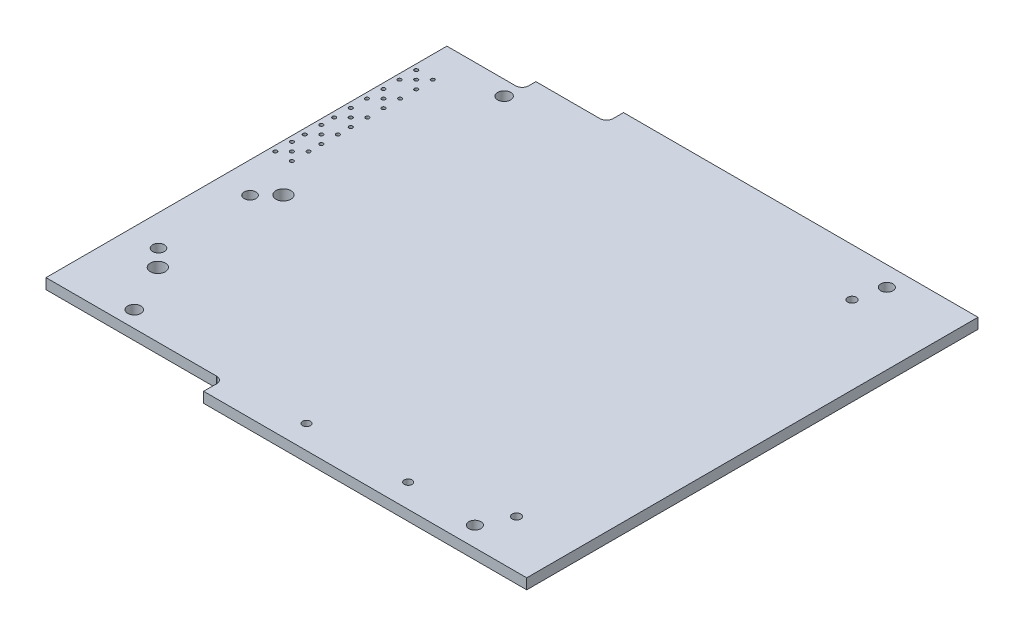
from build123d import *

# Parameters (mm, degrees)
SKETCH2_R           = 1
SKETCH2_R_2         = 1.15
SKETCH2_R_3         = 0.9
SKETCH2_R_4         = 0.595
SKETCH2_R_5         = 0.9271
SKETCH2_R_6         = 0.6604
SKETCH2_R_7         = 0.28
BOSS_EXTRUDE1_DEPTH = 1.6


with BuildPart() as part:
    # Sketch2 → Boss-Extrude1 (new body)
    with BuildSketch(Plane(origin=(0, 0, 0), x_dir=(1, 0, 0), z_dir=(0, 1, 0))):
        with BuildLine():
            Line((10.8682, -3), (10.9, -3))
            Line((10.9, -3), (10.9, -2.9682))
            Line((10.9, -2.9682), (10.9, 65.9682))
            Line((10.9, 65.9682), (10.9, 66))
            Line((10.9, 66), (10.8682, 66))
            Line((10.8682, 66), (-43.2683, 66))
            Line((-43.2683, 66), (-43.3, 66))
            Line((-43.3, 66), (-43.3, 65.9682))
            Line((-43.3, 65.9682), (-43.3, 64.431749961))
            ThreePointArc((-43.3, 64.431749961), (-43.277581689, 64.422432956), (-43.2683, 64.4))
            ThreePointArc((-43.2683, 64.4), (-43.277760728, 64.377389143), (-43.300504779, 64.368253257))
            ThreePointArc((-43.300504779, 64.368253257), (-43.5929, 63.6929), (-44.268253257, 63.400504779))
            ThreePointArc((-44.268253257, 63.400504779), (-44.277389143, 63.377760728), (-44.3, 63.3683))
            ThreePointArc((-44.3, 63.3683), (-44.322432956, 63.377581689), (-44.331749961, 63.4))
            Line((-44.331749961, 63.4), (-54.0682, 63.4))
            Line((-54.0682, 63.4), (-54.1, 63.4))
            Line((-54.1, 63.4), (-54.1, 63.3683))
            Line((-54.1, 63.3683), (-54.1, 62.3318))
            ThreePointArc((-54.1, 62.3318), (-54.077514004, 62.322485996), (-54.0682, 62.3))
            ThreePointArc((-54.0682, 62.3), (-54.077693743, 62.277335692), (-54.100506344, 62.268204031))
            ThreePointArc((-54.100506344, 62.268204031), (-54.392917413, 61.592882587), (-55.068253257, 61.300504779))
            ThreePointArc((-55.068253257, 61.300504779), (-55.077389143, 61.277760728), (-55.1, 61.2683))
            ThreePointArc((-55.1, 61.2683), (-55.122432956, 61.277581689), (-55.131749961, 61.3))
            Line((-55.131749961, 61.3), (-65.5683, 61.3))
            Line((-65.5683, 61.3), (-65.6, 61.3))
            Line((-65.6, 61.3), (-65.6, 61.2683))
            Line((-65.6, 61.2683), (-65.6, 0.0318))
            Line((-65.6, 0.0318), (-65.6, 0))
            Line((-65.6, 0), (-65.5683, 0))
            Line((-65.5683, 0), (-39.5318, 0))
            ThreePointArc((-39.5318, 0), (-39.522485996, 0.022485996), (-39.5, 0.0318))
            ThreePointArc((-39.5, 0.0318), (-39.477335692, 0.022306257), (-39.468204031, -0.000506344))
            ThreePointArc((-39.468204031, -0.000506344), (-38.7929, -0.2929), (-38.500506344, -0.968204031))
            ThreePointArc((-38.500506344, -0.968204031), (-38.477693743, -0.977335692), (-38.4682, -1))
            ThreePointArc((-38.4682, -1), (-38.477514004, -1.022485996), (-38.5, -1.0318))
            Line((-38.5, -1.0318), (-38.5, -2.9682))
            Line((-38.5, -2.9682), (-38.5, -3))
            Line((-38.5, -3), (-38.4682, -3))
            Line((-38.4682, -3), (10.8682, -3))
        make_face()
        with Locations(Location((-54.6, 2.5, 0), (0, 0, 270))):
            Circle(SKETCH2_R, mode=Mode.SUBTRACT)
        with Locations(Location((-58.4, 9.9, 0), (0, 0, 270))):
            Circle(SKETCH2_R_2, mode=Mode.SUBTRACT)
        with Locations(Location((-60.9, 12.5, 0), (0, 0, 270))):
            Circle(SKETCH2_R_3, mode=Mode.SUBTRACT)
        with Locations(Location((-60.9, 26.5, 0), (0, 0, 270))):
            Circle(SKETCH2_R_3, mode=Mode.SUBTRACT)
        with Locations(Location((-58.4, 29.1, 0), (0, 0, 270))):
            Circle(SKETCH2_R_2, mode=Mode.SUBTRACT)
        with Locations(Location((-26.37, 0.6, 0), (0, 0, 270))):
            Circle(SKETCH2_R_4, mode=Mode.SUBTRACT)
        with Locations(Location((-10.83, 0.6, 0), (0, 0, 270))):
            Circle(SKETCH2_R_4, mode=Mode.SUBTRACT)
        with Locations(Location((-0.032, 0.004, 0), (0, 0, 270))):
            Circle(SKETCH2_R_5, mode=Mode.SUBTRACT)
        with Locations(Location((2, 4.3347, 0), (0, 0, 270))):
            Circle(SKETCH2_R_6, mode=Mode.SUBTRACT)
        with Locations(Location((-64.77, 34.23, 0), (0, 0, 270))):
            Circle(SKETCH2_R_7, mode=Mode.SUBTRACT)
        with Locations(Location((-63.5, 35.5, 0), (0, 0, 270))):
            Circle(SKETCH2_R_7, mode=Mode.SUBTRACT)
        with Locations(Location((-62.23, 34.23, 0), (0, 0, 270))):
            Circle(SKETCH2_R_7, mode=Mode.SUBTRACT)
        with Locations(Location((-64.77, 36.77, 0), (0, 0, 270))):
            Circle(SKETCH2_R_7, mode=Mode.SUBTRACT)
        with Locations(Location((-62.23, 36.77, 0), (0, 0, 270))):
            Circle(SKETCH2_R_7, mode=Mode.SUBTRACT)
        with Locations(Location((-64.77, 38.73, 0), (0, 0, 270))):
            Circle(SKETCH2_R_7, mode=Mode.SUBTRACT)
        with Locations(Location((-63.5, 40, 0), (0, 0, 270))):
            Circle(SKETCH2_R_7, mode=Mode.SUBTRACT)
        with Locations(Location((-62.23, 38.73, 0), (0, 0, 270))):
            Circle(SKETCH2_R_7, mode=Mode.SUBTRACT)
        with Locations(Location((-64.77, 41.27, 0), (0, 0, 270))):
            Circle(SKETCH2_R_7, mode=Mode.SUBTRACT)
        with Locations(Location((-62.23, 41.27, 0), (0, 0, 270))):
            Circle(SKETCH2_R_7, mode=Mode.SUBTRACT)
        with Locations(Location((-64.77, 43.23, 0), (0, 0, 270))):
            Circle(SKETCH2_R_7, mode=Mode.SUBTRACT)
        with Locations(Location((-62.23, 43.23, 0), (0, 0, 270))):
            Circle(SKETCH2_R_7, mode=Mode.SUBTRACT)
        with Locations(Location((-63.5, 44.5, 0), (0, 0, 270))):
            Circle(SKETCH2_R_7, mode=Mode.SUBTRACT)
        with Locations(Location((-64.77, 45.77, 0), (0, 0, 270))):
            Circle(SKETCH2_R_7, mode=Mode.SUBTRACT)
        with Locations(Location((-62.23, 45.77, 0), (0, 0, 270))):
            Circle(SKETCH2_R_7, mode=Mode.SUBTRACT)
        with Locations(Location((-64.77, 48.23, 0), (0, 0, 270))):
            Circle(SKETCH2_R_7, mode=Mode.SUBTRACT)
        with Locations(Location((-62.23, 48.23, 0), (0, 0, 270))):
            Circle(SKETCH2_R_7, mode=Mode.SUBTRACT)
        with Locations(Location((-63.5, 49.5, 0), (0, 0, 270))):
            Circle(SKETCH2_R_7, mode=Mode.SUBTRACT)
        with Locations(Location((-64.77, 50.77, 0), (0, 0, 270))):
            Circle(SKETCH2_R_7, mode=Mode.SUBTRACT)
        with Locations(Location((-62.23, 50.77, 0), (0, 0, 270))):
            Circle(SKETCH2_R_7, mode=Mode.SUBTRACT)
        with Locations(Location((-64.77, 53.23, 0), (0, 0, 270))):
            Circle(SKETCH2_R_7, mode=Mode.SUBTRACT)
        with Locations(Location((-63.5, 54.5, 0), (0, 0, 270))):
            Circle(SKETCH2_R_7, mode=Mode.SUBTRACT)
        with Locations(Location((-62.23, 53.23, 0), (0, 0, 270))):
            Circle(SKETCH2_R_7, mode=Mode.SUBTRACT)
        with Locations(Location((-64.77, 55.77, 0), (0, 0, 270))):
            Circle(SKETCH2_R_7, mode=Mode.SUBTRACT)
        with Locations(Location((-62.23, 55.77, 0), (0, 0, 270))):
            Circle(SKETCH2_R_7, mode=Mode.SUBTRACT)
        with Locations(Location((-54.6, 59.05, 0), (0, 0, 270))):
            Circle(SKETCH2_R, mode=Mode.SUBTRACT)
        with Locations(Location((-1.05, 58.6907, 0), (0, 0, 270))):
            Circle(SKETCH2_R_6, mode=Mode.SUBTRACT)
        with Locations(Location((-0.032, 62.996, 0), (0, 0, 270))):
            Circle(SKETCH2_R_5, mode=Mode.SUBTRACT)
    extrude(amount=BOSS_EXTRUDE1_DEPTH)


solid = part.part
